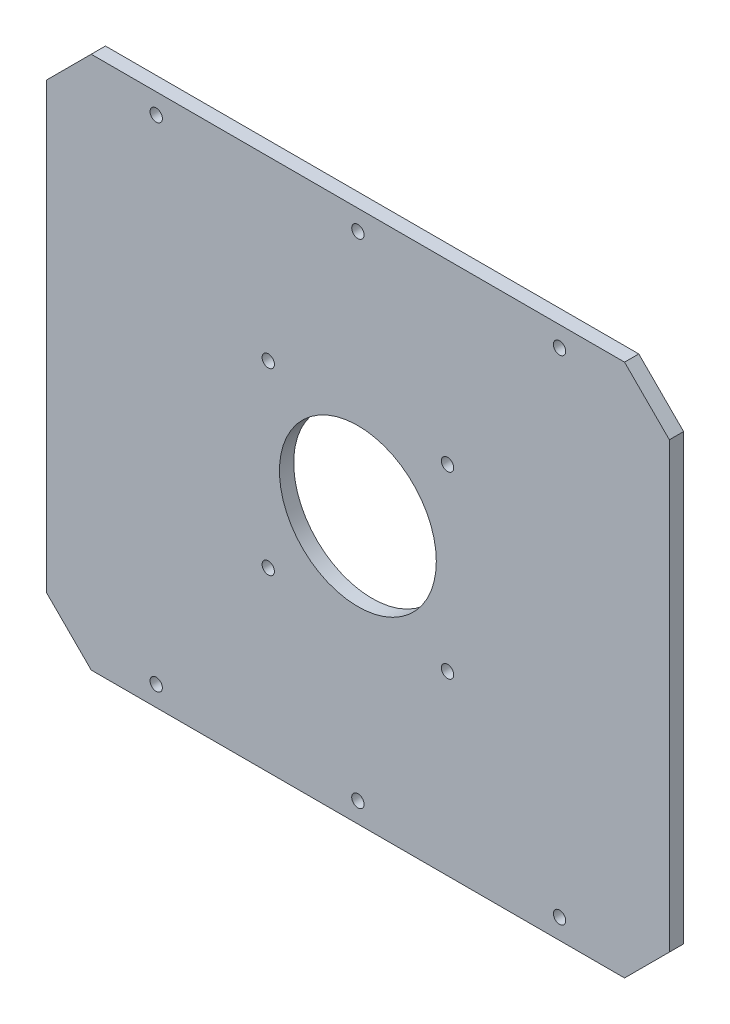
from build123d import *

# Parameters (mm, degrees)
SKETCH1_W           = 278
SKETCH1_H           = 238
BOSS_EXTRUDE1_DEPTH = 6.35
SKETCH2_R           = 35
SKETCH2_R_2         = 2.75
CUT_EXTRUDE1_DEPTH  = 184.091022445
CHAMFER1_SIZE       = 20
SKETCH4_R           = 2.75
CUT_EXTRUDE2_DEPTH  = 76.2


with BuildPart() as part:
    # Sketch1 → Boss-Extrude1 (new body)
    with BuildSketch(Plane.XY):
        Rectangle(SKETCH1_W, SKETCH1_H)
    extrude(amount=BOSS_EXTRUDE1_DEPTH)

    # Sketch2 → Cut-Extrude1 (cut, through all)
    with BuildSketch(Plane.XY.offset(6.35)):
        Circle(SKETCH2_R)
        with Locations((-40, 40)):
            Circle(SKETCH2_R_2)
        with Locations(Location((40, 40, 0), (0, 0, 180))):
            Circle(SKETCH2_R_2)
        with Locations((40, -40)):
            Circle(SKETCH2_R_2)
        with Locations(Location((-40, -40, 0), (0, 0, 180))):
            Circle(SKETCH2_R_2)
    extrude(amount=-CUT_EXTRUDE1_DEPTH, mode=Mode.SUBTRACT)

    # Chamfer1
    chamfer1_edges = [part.edges().sort_by_distance(p)[0] for p in [
        (-139, 119, 3.175),
        (139, 119, 3.175),
        (139, -119, 3.175),
        (-139, -119, 3.175),
    ]]
    chamfer(chamfer1_edges, length=CHAMFER1_SIZE)

    # Sketch4 → Cut-Extrude2 (cut)
    with BuildSketch(Plane.XY.offset(6.35)):
        with Locations((-90, 110)):
            Circle(SKETCH4_R)
        with Locations((0, 110)):
            Circle(SKETCH4_R)
        with Locations((90, 110)):
            Circle(SKETCH4_R)
        with Locations((90, -110)):
            Circle(SKETCH4_R)
        with Locations((0, -110)):
            Circle(SKETCH4_R)
        with Locations((-90, -110)):
            Circle(SKETCH4_R)
    extrude(amount=-CUT_EXTRUDE2_DEPTH, mode=Mode.SUBTRACT)


solid = part.part
